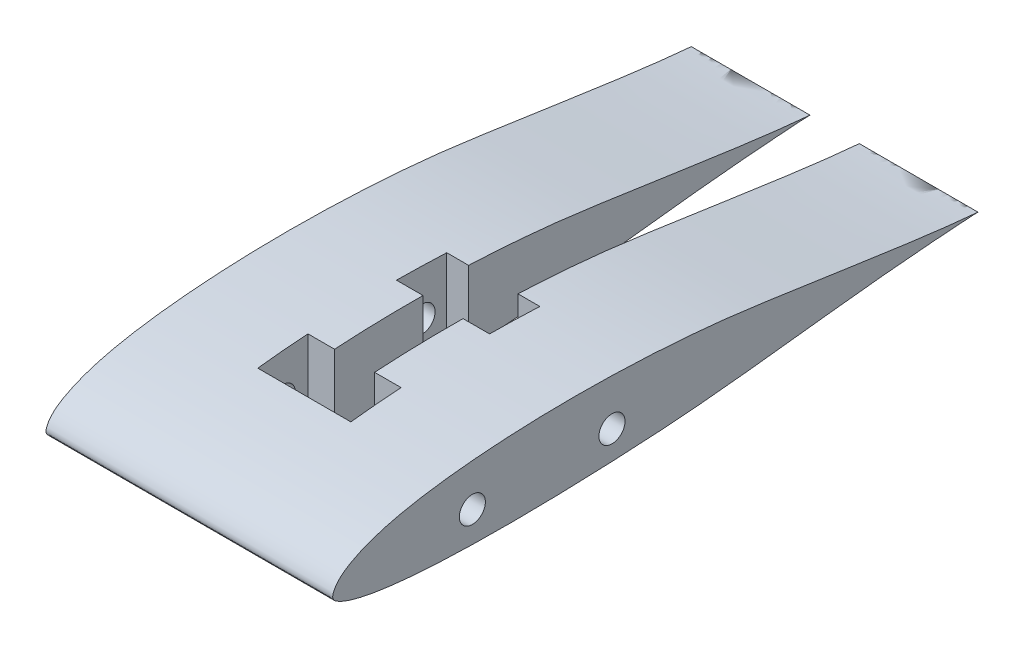
from build123d import *

# Parameters (mm, degrees)
SKETCH4_R               = 7
BOSS_EXTRUDE1_DEPTH     = 932
CUT_EXTRUDE1_DEPTH      = 995.756898407
CUT_EXTRUDE1_DEPTH_BACK = 995.756898407
SKETCH5_OUTSIDE_W       = 2245.282
SKETCH5_OUTSIDE_H       = 727.882
SKETCH5_OUTSIDE_W_2     = 154
SKETCH5_OUTSIDE_H_2     = 505.14150215
CUT_EXTRUDE2_DEPTH      = 357.154863447
CUT_EXTRUDE2_DEPTH_BACK = 357.154863447
SKETCH6_W               = 26.5
SKETCH6_H               = 183.350009514
SKETCH6_W_2             = 50
SKETCH6_H_2             = 27
SKETCH6_W_3             = 21.5
SKETCH6_H_3             = 47.5


with BuildPart() as part:
    # Sketch4 → Boss-Extrude1 (new, symmetric)
    with BuildSketch(Plane(origin=(0, 0, 0), x_dir=(0, 0, -1), z_dir=(1, 0, 0))):
        with BuildLine():
            add(Edge.make_bspline(
                [(346.6, 5.483530104), (346.597852581, 5.492234852), (345.16723415, 5.576896388), (343.710437855, 5.750505114), (340.208114048, 6.053605863), (335.908167932, 6.496025868), (330.293711808, 7.115488714), (323.660620149, 7.896785978), (316.003933549, 8.865926614), (307.431372403, 10.004174116), (298.020938544, 11.305846068), (287.866433047, 12.759355857), (277.062876694, 14.340605314), (265.708526479, 16.023149126), (253.900407257, 17.762921723), (241.742125064, 19.54139789), (229.33289281, 21.278411218), (216.768564816, 22.955709456), (204.080510678, 24.399161458), (191.289743253, 25.544722366), (178.433244398, 26.496433408), (165.557429847, 27.217240279), (152.734872685, 27.71026724), (140.032960763, 28.000573629), (127.520231074, 28.060282277), (115.265068923, 27.917552231), (103.334524445, 27.556364609), (91.799679572, 26.999278296), (80.724502879, 26.24179681), (70.175666978, 25.305655625), (60.216722664, 24.181255697), (50.90506962, 22.888317638), (42.294993085, 21.408396171), (34.426534822, 19.779477041), (27.334834915, 17.957994148), (21.04576914, 15.943339469), (15.54687374, 13.824278978), (10.869268093, 11.57945454), (7.024479925, 9.276142277), (4.007199897, 6.944236987), (1.837951912, 4.540202262), (0.539531822, 2.205290478), (-0.217503198, 0.032826153), (0.442673002, -2.133924861), (2.553907707, -3.574513487), (5.407974125, -5.031535481), (9.322158849, -6.431358468), (14.175740458, -7.751926775), (19.97039139, -8.968608871), (26.665912145, -10.054312997), (34.22951234, -11.006806529), (42.623685108, -11.812618015), (51.800356108, -12.468063174), (61.709730429, -12.97776782), (72.293558129, -13.33419688), (83.491672161, -13.541184409), (95.236104316, -13.597482494), (107.456433885, -13.509101712), (120.077717148, -13.280256119), (133.020305497, -12.91494407), (146.201332933, -12.42102472), (159.535028595, -11.790723908), (172.932546654, -11.034822491), (186.324176452, -10.105086328), (199.659670611, -8.972362069), (212.904439697, -7.689494636), (226.009264251, -6.293580943), (238.902781852, -4.829633249), (251.511264489, -3.363062808), (263.738937027, -1.939214535), (275.485374487, -0.614889669), (286.63992935, 0.59053908), (297.096449209, 1.656719781), (306.755734647, 2.57055132), (315.519646776, 3.333855564), (323.309238943, 3.960495299), (330.022500194, 4.448649663), (335.69054278, 4.84240532), (340.042467931, 5.174654025), (343.624043929, 5.380393944), (345.115114939, 5.492869011), (346.602192895, 5.474641015), (346.6, 5.483530104)],
                knots=[0, 0, 0, 0, 0.000971238, 0.003795505, 0.008388897, 0.014710859, 0.022678045, 0.032193589, 0.043157837, 0.055447764, 0.068945081, 0.083520974, 0.099034505, 0.115338149, 0.132292378, 0.149748787, 0.167548161, 0.185533001, 0.203606824, 0.221802152, 0.24009478, 0.258381326, 0.27659384, 0.294615696, 0.312363137, 0.329758286, 0.346688677, 0.363076304, 0.378823916, 0.393853851, 0.408070676, 0.421404124, 0.433792848, 0.445184773, 0.455537591, 0.464887425, 0.473229999, 0.480557633, 0.486906624, 0.492238034, 0.496718365, 0.500526342, 0.503606091, 0.506177593, 0.509478573, 0.514052139, 0.519911012, 0.527046393, 0.535434515, 0.5450494, 0.555862283, 0.567819647, 0.58087606, 0.594950041, 0.60997775, 0.625870113, 0.642537247, 0.65987894, 0.677794442, 0.6961728, 0.714892974, 0.733838965, 0.752890035, 0.771908419, 0.790874706, 0.8097546, 0.82844771, 0.846871331, 0.864890849, 0.882382264, 0.899177614, 0.915117479, 0.930053399, 0.943838005, 0.956340241, 0.967439356, 0.977019227, 0.9850097, 0.991382471, 0.99609114, 0.999008194, 1, 1, 1, 1], degree=3))
        make_face()
        with Locations((75, 3)):
            Circle(SKETCH4_R, mode=Mode.SUBTRACT)
        with Locations((150, 3)):
            Circle(SKETCH4_R, mode=Mode.SUBTRACT)
    extrude(amount=BOSS_EXTRUDE1_DEPTH, both=True)

    # Sketch5 outside → Cut-Extrude1 (cut, two sides: drawn at the far end of the back side and taken through both)
    with BuildSketch(Plane(origin=(0, 0, 0), x_dir=(1, 0, 0), z_dir=(0, 1, 0)).offset(-CUT_EXTRUDE1_DEPTH_BACK)):
        with Locations((0, 173.3)):
            Rectangle(SKETCH5_OUTSIDE_W, SKETCH5_OUTSIDE_H)
        with Locations((0, 133.712770638)):
            Rectangle(SKETCH5_OUTSIDE_W_2, SKETCH5_OUTSIDE_H_2, mode=Mode.SUBTRACT)
    extrude(amount=CUT_EXTRUDE1_DEPTH + CUT_EXTRUDE1_DEPTH_BACK, mode=Mode.SUBTRACT)

    # Sketch6 → Cut-Extrude2 (cut, two sides: drawn at the far end of the back side and taken through both)
    with BuildSketch(Plane(origin=(0, 0, 0), x_dir=(1, 0, 0), z_dir=(0, 1, 0)).offset(-CUT_EXTRUDE2_DEPTH_BACK)):
        with Locations((0, 254.925004757)):
            Rectangle(SKETCH6_W, SKETCH6_H)
        with Locations((0, 149.75)):
            Rectangle(SKETCH6_W_2, SKETCH6_H_2)
        with Locations((0, 112.5)):
            Rectangle(SKETCH6_W_3, SKETCH6_H_3)
        with Locations((0, 75.25)):
            Rectangle(SKETCH6_W_2, SKETCH6_H_2)
    extrude(amount=CUT_EXTRUDE2_DEPTH + CUT_EXTRUDE2_DEPTH_BACK, mode=Mode.SUBTRACT)


solid = part.part
